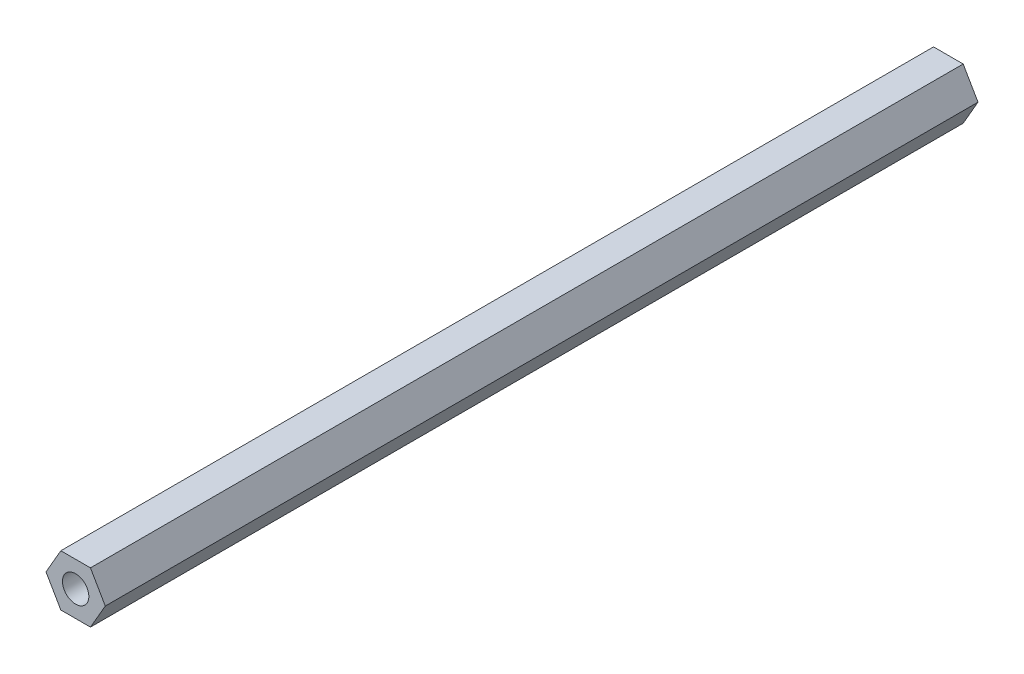
from build123d import *

# Parameters (mm, degrees)
SKETCH1_R           = 3.2639
BOSS_EXTRUDE1_DEPTH = 215.9


with BuildPart() as part:
    # Sketch1 → Boss-Extrude1 (new body)
    with BuildSketch(Plane.XY):
        Polygon((-7.332348419, 0), (-3.666174209, -6.35), (3.666174209, -6.35), (7.332348419, 0), (3.666174209, 6.35), (-3.666174209, 6.35), align=None)
        Circle(SKETCH1_R, mode=Mode.SUBTRACT)
    extrude(amount=BOSS_EXTRUDE1_DEPTH)


solid = part.part
